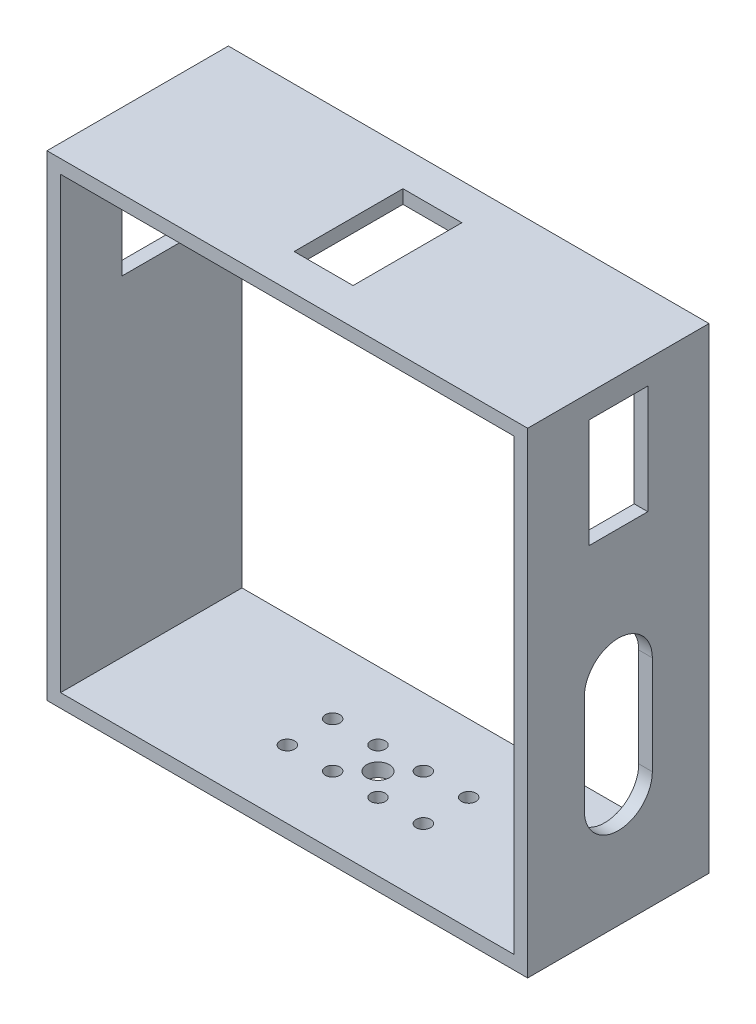
from build123d import *

# Parameters (mm, degrees)
SKETCH_1_W                      = 106
SKETCH_1_H                      = 105
EXTRUDE_1_DEPTH                 = 40
CUT_EXTRUDE_1_DEPTH             = 125.233650836
CUT_EXTRUDE_1_DEPTH_BACK        = 125.233650836
SKETCH_3_W                      = 100
SKETCH_3_H                      = 99
CUT_EXTRUDE_3_DEPTH             = 1
CUT_EXTRUDE_3_DEPTH_BACK        = 3
SKETCH_7_R                      = 2.5
SKETCH_7_R_2                    = 1.6
CUT_EXTRUDE_4_REACH             = 126.234
SKETCH_6_W                      = 13
SKETCH_6_H                      = 24
CUT_EXTRUDE_4_DIRECTION_2_DEPTH = 125.233650836
CUT_EXTRUDE_5_DEPTH             = 155.470061824
CUT_EXTRUDE_5_DEPTH_BACK        = 155.470061824
SKETCH_10_W                     = 13
SKETCH_10_H                     = 24
CUT_EXTRUDE_6_REACH             = 156.47
CUT_EXTRUDE_6_DIRECTION_2_DEPTH = 155.470061824


with BuildPart() as part:
    # 草图1 → 凸台-拉伸1 (new body)
    with BuildSketch(Plane.XY):
        with Locations((0, 52.5)):
            Rectangle(SKETCH_1_W, SKETCH_1_H)
    extrude(amount=EXTRUDE_1_DEPTH)

    # 草图3 → 切除-拉伸1 (cut, two sides: drawn at the far end of the back side and taken through both)
    with BuildSketch(Plane(origin=(0, 0, 0), x_dir=(-1, 0, 0), z_dir=(0, 0, -1)).offset(-CUT_EXTRUDE_1_DEPTH_BACK)):
        with Locations((0, 52.5)):
            Rectangle(SKETCH_3_W, SKETCH_3_H)
    extrude(amount=CUT_EXTRUDE_1_DEPTH + CUT_EXTRUDE_1_DEPTH_BACK, mode=Mode.SUBTRACT)

    # 草图7 → 切除-拉伸3 (cut, two sides: drawn at the far end of the back side and taken through both)
    with BuildSketch(Plane.XZ.offset(-CUT_EXTRUDE_3_DEPTH_BACK)):
        with Locations(Location((0, 20, 0), (0, 0, 180))):
            Circle(SKETCH_7_R)
        with Locations(Location((5, 25, 0), (0, 0, 180))):
            Circle(SKETCH_7_R_2)
        with Locations(Location((5, 15, 0), (0, 0, 180))):
            Circle(SKETCH_7_R_2)
        with Locations(Location((-5, 15, 0), (0, 0, 180))):
            Circle(SKETCH_7_R_2)
        with Locations(Location((-5, 25, 0), (0, 0, 180))):
            Circle(SKETCH_7_R_2)
        with Locations(Location((15, 25, 0), (0, 0, 180))):
            Circle(SKETCH_7_R_2)
        with Locations(Location((-15, 25, 0), (0, 0, 180))):
            Circle(SKETCH_7_R_2)
        with Locations(Location((15, 15, 0), (0, 0, 180))):
            Circle(SKETCH_7_R_2)
        with Locations(Location((-15, 15, 0), (0, 0, 180))):
            Circle(SKETCH_7_R_2)
    extrude(amount=CUT_EXTRUDE_3_DEPTH + CUT_EXTRUDE_3_DEPTH_BACK, mode=Mode.SUBTRACT)

    # 草图6 → 切除-拉伸4 (cut, up to next)
    with BuildSketch(Plane(origin=(0, 105, 0), x_dir=(1, 0, 0), z_dir=(0, 1, 0)), mode=Mode.PRIVATE) as cut_extrude_4_sk1:
        with Locations((0, -20)):
            Rectangle(SKETCH_6_W, SKETCH_6_H)
    cut_extrude_4_tool1 = extrude(cut_extrude_4_sk1.sketch, amount=-CUT_EXTRUDE_4_REACH, mode=Mode.PRIVATE) & part.part
    add(cut_extrude_4_tool1.solids().sort_by_distance((0, 105, 20))[0], mode=Mode.SUBTRACT)

    # 草图6 → 切除-拉伸4 direction 2 (cut)
    with BuildSketch(Plane(origin=(0, 105, 0), x_dir=(1, 0, 0), z_dir=(0, 1, 0))):
        with Locations((0, -20)):
            Rectangle(SKETCH_6_W, SKETCH_6_H)
    extrude(amount=CUT_EXTRUDE_4_DIRECTION_2_DEPTH, mode=Mode.SUBTRACT)

    # 草图10 → 切除-拉伸5 (cut, two sides: drawn at the far end of the back side and taken through both)
    with BuildSketch(Plane.ZY.offset(53).offset(-CUT_EXTRUDE_5_DEPTH_BACK)):
        with Locations((20, 87.806952357)):
            Rectangle(SKETCH_10_W, SKETCH_10_H)
    extrude(amount=CUT_EXTRUDE_5_DEPTH + CUT_EXTRUDE_5_DEPTH_BACK, mode=Mode.SUBTRACT)

    # 草图12 → 切除-拉伸6 (cut, up to next)
    with BuildSketch(Plane(origin=(53, 0, 0), x_dir=(0, 0, -1), z_dir=(1, 0, 0)), mode=Mode.PRIVATE) as cut_extrude_6_sk1:
        with BuildLine():
            Line((-27.5, 25.649961527), (-27.5, 47.398469004))
            ThreePointArc((-27.5, 47.398469004), (-20, 54.898469004), (-12.5, 47.398469004))
            Line((-12.5, 47.398469004), (-12.5, 25.649961527))
            ThreePointArc((-12.5, 25.649961527), (-20, 18.149961527), (-27.5, 25.649961527))
        make_face()
    cut_extrude_6_tool1 = extrude(cut_extrude_6_sk1.sketch, amount=-CUT_EXTRUDE_6_REACH, mode=Mode.PRIVATE) & part.part
    add(cut_extrude_6_tool1.solids().sort_by_distance((53, 36.524215, 20))[0], mode=Mode.SUBTRACT)

    # 草图12 → 切除-拉伸6 direction 2 (cut)
    with BuildSketch(Plane(origin=(53, 0, 0), x_dir=(0, 0, -1), z_dir=(1, 0, 0))):
        with BuildLine():
            Line((-27.5, 25.649961527), (-27.5, 47.398469004))
            ThreePointArc((-27.5, 47.398469004), (-20, 54.898469004), (-12.5, 47.398469004))
            Line((-12.5, 47.398469004), (-12.5, 25.649961527))
            ThreePointArc((-12.5, 25.649961527), (-20, 18.149961527), (-27.5, 25.649961527))
        make_face()
    extrude(amount=CUT_EXTRUDE_6_DIRECTION_2_DEPTH, mode=Mode.SUBTRACT)


solid = part.part
